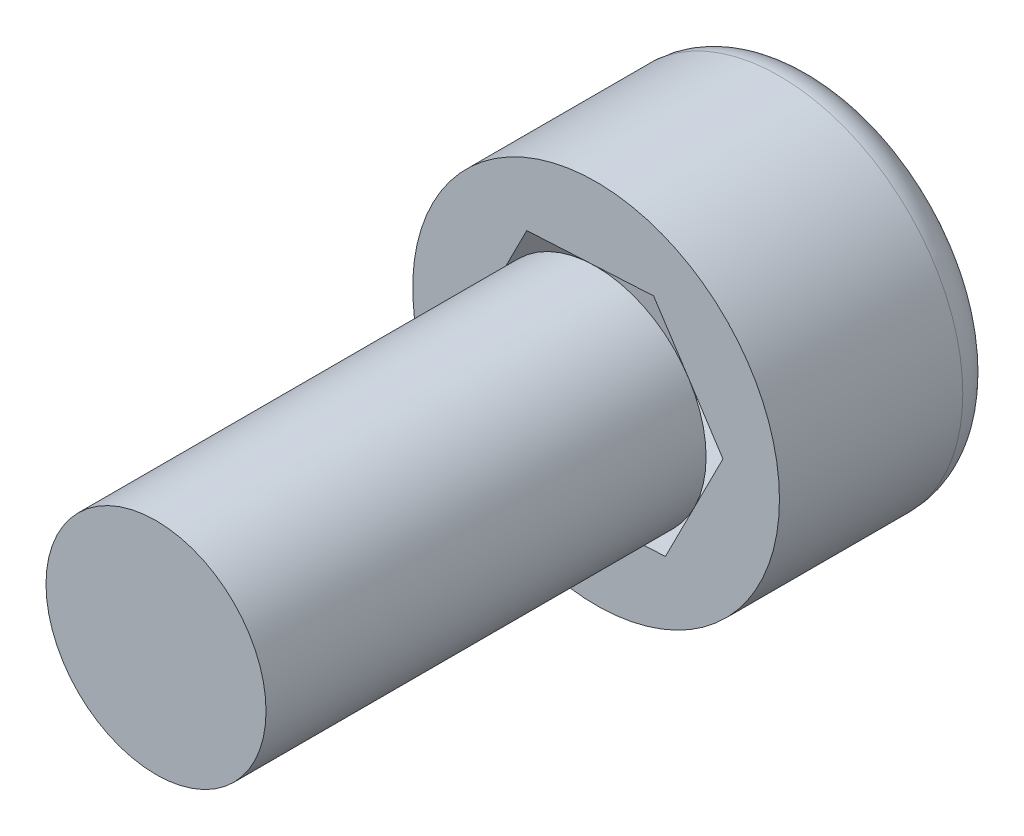
from build123d import *

# Parameters (mm, degrees)
SKETCH1_R           = 2.5
BOSS_EXTRUDE1_DEPTH = 3
SKETCH2_R           = 1.5
BOSS_EXTRUDE2_DEPTH = 6
CUT_EXTRUDE1_DEPTH  = 3
FILLET1_R           = 0.5


with BuildPart() as part:
    # Sketch1 → Boss-Extrude1 (new body)
    with BuildSketch(Plane.XY):
        Circle(SKETCH1_R)
    extrude(amount=BOSS_EXTRUDE1_DEPTH)

    # Sketch2 → Boss-Extrude2 (add)
    with BuildSketch(Plane.XY.offset(3)):
        Circle(SKETCH2_R)
    extrude(amount=BOSS_EXTRUDE2_DEPTH)

    # Sketch3 → Cut-Extrude1 (cut)
    with BuildSketch(Plane(origin=(0, 0, 0), x_dir=(-1, 0, 0), z_dir=(0, 0, -1))):
        Polygon((0.784462107, -1.544221229), (1.729565866, -0.092746502), (0.94510376, 1.451474727), (-0.784462107, 1.544221229), (-1.729565866, 0.092746502), (-0.94510376, -1.451474727), align=None)
    extrude(amount=-CUT_EXTRUDE1_DEPTH, mode=Mode.SUBTRACT)


with BuildPart() as cut_extrude1_piece_1:
    # of the separate pieces the step leaves, piece 1, a body of its own (cut_extrude1_pieces)
    add(part.part.solids().sort_by_distance((1.5, 0, 3))[0])


with BuildPart() as cut_extrude1_piece_2:
    # of the separate pieces the step leaves, piece 2, a body of its own (cut_extrude1_pieces)
    add(part.part.solids().sort_by_distance((2.5, 0, 0))[0])

    # Fillet1
    fillet1_edges = [cut_extrude1_piece_2.edges().sort_by_distance(p)[0] for p in [
        (-2.5, 0, 0),
    ]]
    fillet(fillet1_edges, radius=FILLET1_R)


solid = Compound([cut_extrude1_piece_1.part, cut_extrude1_piece_2.part])
